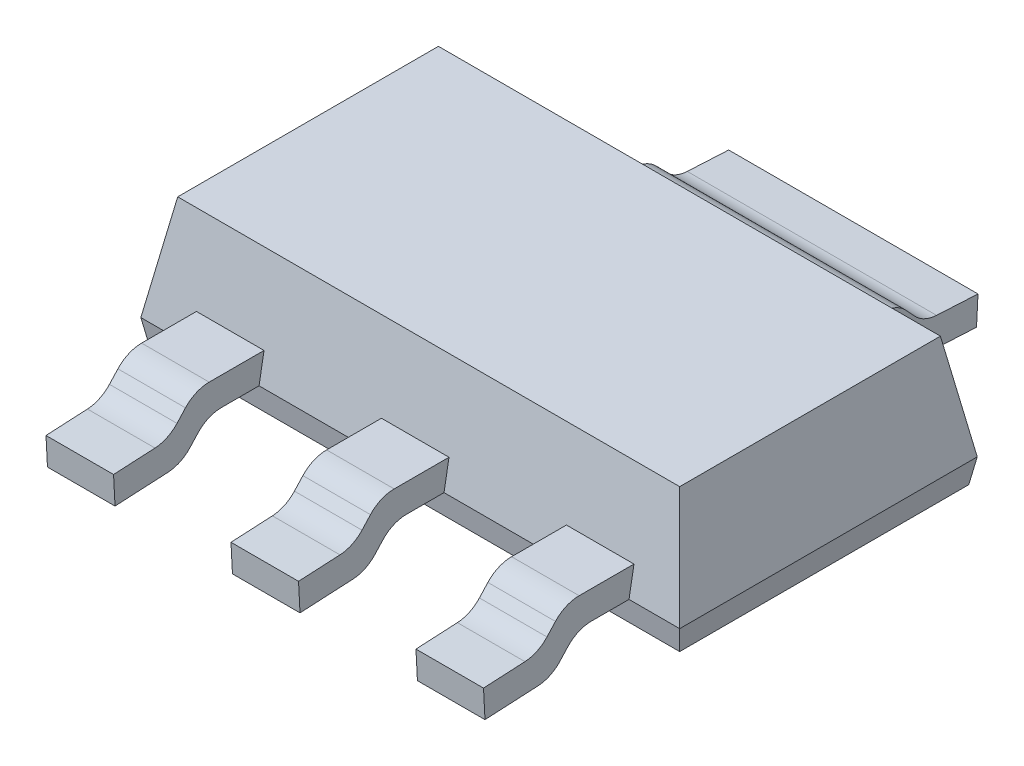
from build123d import *

# Parameters (mm, degrees)
SKETCH1_W                     = 6.7
SKETCH1_H                     = 3.7
BOSS_EXTRUDE1_DEPTH           = 1.3
BOSS_EXTRUDE1_TAPER           = 10
BOSS_EXTRUDE1_OTHER_WAY_DEPTH = 0.3
BOSS_EXTRUDE1_OTHER_WAY_TAPER = 10
BOSS_EXTRUDE2_DEPTH           = 0.84
LPATTERN1_COUNT               = 3
LPATTERN1_PITCH               = 2.3
BOSS_EXTRUDE3_DEPTH           = 3.1


with BuildPart() as part:
    # Sketch1 → Boss-Extrude1 (new body)
    with BuildSketch(Plane(origin=(0, 0, 0), x_dir=(1, 0, 0), z_dir=(0, 1, 0))):
        with Locations((3.35, 1.85)):
            Rectangle(SKETCH1_W, SKETCH1_H)
    extrude(amount=BOSS_EXTRUDE1_DEPTH, taper=BOSS_EXTRUDE1_TAPER)

    # Sketch1 → Boss-Extrude1 other way (add)
    with BuildSketch(Plane(origin=(0, 0, 0), x_dir=(1, 0, 0), z_dir=(0, 1, 0))):
        with Locations((3.35, 1.85)):
            Rectangle(SKETCH1_W, SKETCH1_H)
    extrude(amount=-BOSS_EXTRUDE1_OTHER_WAY_DEPTH, taper=BOSS_EXTRUDE1_OTHER_WAY_TAPER)

    # Sketch2 → Boss-Extrude2 (add)
    with BuildSketch(Plane(origin=(0.63, 0, 0), x_dir=(0, 0, -1), z_dir=(1, 0, 0))):
        with BuildLine():
            Line((0.061714443, 0.35), (0.030857222, 0.35))
            Line((0.030857222, 0.35), (-0.62020956, 0.35))
            ThreePointArc((-0.62020956, 0.35), (-0.781213948, 0.316166065), (-0.914981276, 0.220387936))
            Line((-0.914981276, 0.220387936), (-1.020065184, 0.105827484))
            ThreePointArc((-1.020065184, 0.105827484), (-1.144302574, 0.014389434), (-1.293902517, -0.023236394))
            Line((-1.293902517, -0.023236394), (-1.809158792, -0.050239831))
            Line((-1.809158792, -0.050239831), (-1.790841208, -0.399760169))
            Line((-1.790841208, -0.399760169), (-1.132697448, -0.365268316))
            ThreePointArc((-1.132697448, -0.365268316), (-0.983097505, -0.327642487), (-0.858860115, -0.236204437))
            Line((-0.858860115, -0.236204437), (-0.761085158, -0.129612064))
            ThreePointArc((-0.761085158, -0.129612064), (-0.62731783, -0.033833935), (-0.466313443, 0))
            Line((-0.466313443, 0), (0, 0))
            Line((0, 0), (0.061714443, 0.35))
        make_face()
    boss_extrude2 = extrude(amount=BOSS_EXTRUDE2_DEPTH)

    # LPattern1: Boss-Extrude2 ×3
    with Locations(*[(i * LPATTERN1_PITCH, 0, 0) for i in range(1, LPATTERN1_COUNT)]):
        add(boss_extrude2)

    # Sketch3 → Boss-Extrude3 (add)
    with BuildSketch(Plane(origin=(1.8, 0, 0), x_dir=(0, 0, -1), z_dir=(1, 0, 0))):
        with BuildLine():
            Line((3.7, 0), (3.638285557, 0.35))
            Line((3.638285557, 0.35), (4.32020956, 0.35))
            ThreePointArc((4.32020956, 0.35), (4.481213948, 0.316166065), (4.614981276, 0.220387936))
            Line((4.614981276, 0.220387936), (4.720065184, 0.105827484))
            ThreePointArc((4.720065184, 0.105827484), (4.844302574, 0.014389434), (4.993902517, -0.023236394))
            Line((4.993902517, -0.023236394), (5.509158792, -0.050239831))
            Line((5.509158792, -0.050239831), (5.490841208, -0.399760169))
            Line((5.490841208, -0.399760169), (4.832697448, -0.365268316))
            ThreePointArc((4.832697448, -0.365268316), (4.683097505, -0.327642487), (4.558860115, -0.236204437))
            Line((4.558860115, -0.236204437), (4.461085158, -0.129612064))
            ThreePointArc((4.461085158, -0.129612064), (4.32731783, -0.033833935), (4.166313443, 0))
            Line((4.166313443, 0), (3.7, 0))
        make_face()
    extrude(amount=BOSS_EXTRUDE3_DEPTH)


solid = part.part
